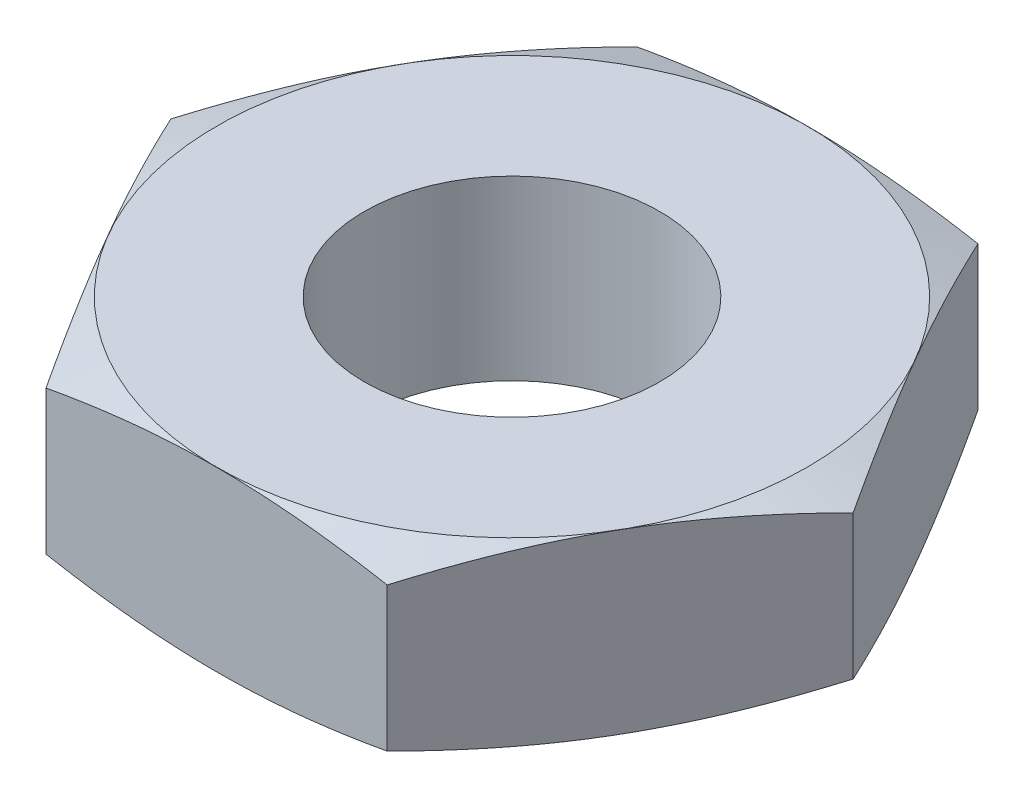
from build123d import *

# Parameters (mm, degrees)
SKETCH2_R           = 1
BOSS_EXTRUDE1_DEPTH = 0.6


with BuildPart() as part:
    # Sketch2 → Boss-Extrude1 (new, symmetric)
    with BuildSketch(Plane(origin=(0, 0, 0), x_dir=(1, 0, 0), z_dir=(0, 1, 0))):
        Polygon((2.309401077, 0), (1.154700538, 2), (-1.154700538, 2), (-2.309401077, 0), (-1.154700538, -2), (1.154700538, -2), align=None)
        with Locations(Location((0, 0, 0), (0, 0, 270))):
            Circle(SKETCH2_R, mode=Mode.SUBTRACT)
    extrude(amount=BOSS_EXTRUDE1_DEPTH, both=True)

    # Sketch3 → Cut-Revolve1 (revolve, cut)
    with BuildSketch(Plane.XY, mode=Mode.PRIVATE) as cut_revolve1_sk:
        Polygon((-2.309401077, 0.6), (-1.999401077, 0.6), (-2.309401077, 0.487169227), align=None)
        Polygon((-1.999401077, -0.6), (-2.309401077, -0.487169227), (-2.309401077, -0.6), align=None)
    revolve(cut_revolve1_sk.sketch.rotate(Axis((0, 0, 0), (0, 1, 0)), 180), axis=Axis((0, 0, 0), (0, 1, 0)), mode=Mode.SUBTRACT)


solid = part.part
